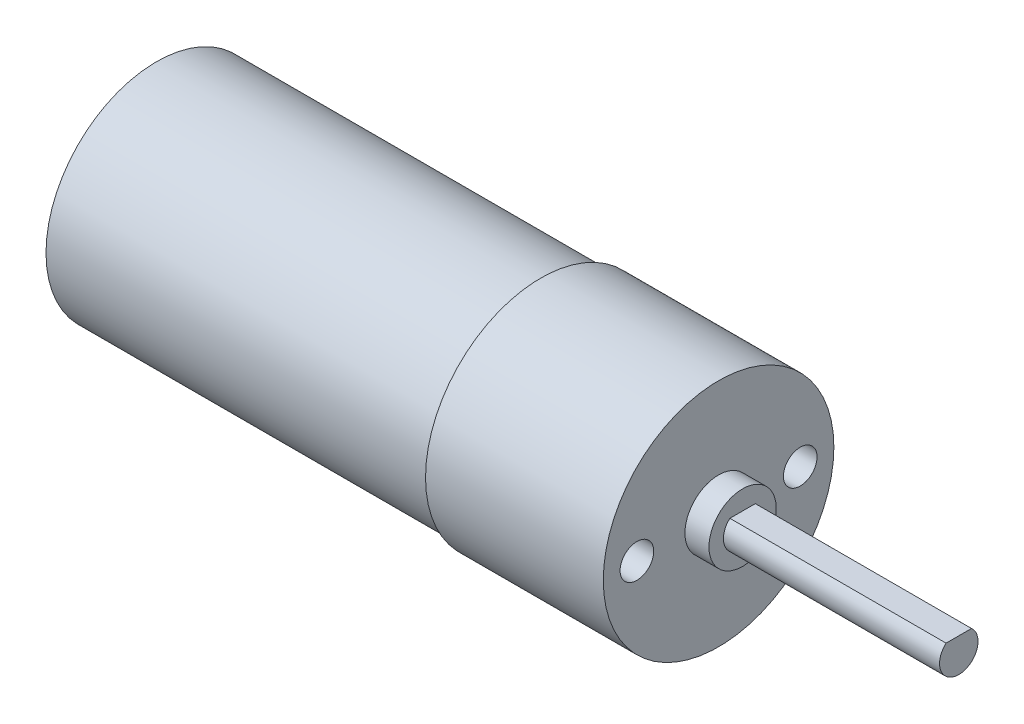
from build123d import *

# Parameters (mm, degrees)
CUT_EXTRUDE1_START = -22.5
CUT_EXTRUDE1_DEPTH = 22.5
SKETCH4_R          = 1.75
CUT_EXTRUDE2_DEPTH = 5
SKETCH5_R          = 12
SKETCH5_R_2        = 11.5
CUT_EXTRUDE3_DEPTH = 40


with BuildPart() as part:
    # Sketch1 → Revolve1 (revolve)
    with BuildSketch(Plane(origin=(0, 0, 0), x_dir=(1, 0, 0), z_dir=(0, 1, 0)), mode=Mode.PRIVATE) as revolve1_sk:
        Polygon((-25, 12), (-83.5, 12), (-83.5, 0), (0, 0), (0, 2), (-22.5, 2), (-22.5, 3.5), (-25, 3.5), align=None)
    revolve(revolve1_sk.sketch.rotate(Axis((-83.5, 0, 0), (1, 0, 0)), 180), axis=Axis((-83.5, 0, 0), (1, 0, 0)))

    # Sketch2 → Cut-Extrude1 (cut)
    with BuildSketch(Plane(origin=(0, 0, 0), x_dir=(0, 0, -1), z_dir=(1, 0, 0)).offset(CUT_EXTRUDE1_START)):
        with BuildLine():
            Line((1.322875656, 1.5), (-1.322875656, 1.5))
            ThreePointArc((-1.322875656, 1.5), (0, 2), (1.322875656, 1.5))
        make_face()
    extrude(amount=CUT_EXTRUDE1_DEPTH, mode=Mode.SUBTRACT)

    # Sketch4 → Cut-Extrude2 (cut)
    with BuildSketch(Plane(origin=(-25, 0, 0), x_dir=(0, 0, -1), z_dir=(1, 0, 0))):
        with Locations((-8.5, 0)):
            Circle(SKETCH4_R)
        with Locations((8.5, 0)):
            Circle(SKETCH4_R)
    extrude(amount=-CUT_EXTRUDE2_DEPTH, mode=Mode.SUBTRACT)

    # Sketch5 → Cut-Extrude3 (cut)
    with BuildSketch(Plane.ZY.offset(83.5)):
        Circle(SKETCH5_R)
        Circle(SKETCH5_R_2, mode=Mode.SUBTRACT)
    extrude(amount=-CUT_EXTRUDE3_DEPTH, mode=Mode.SUBTRACT)


solid = part.part
